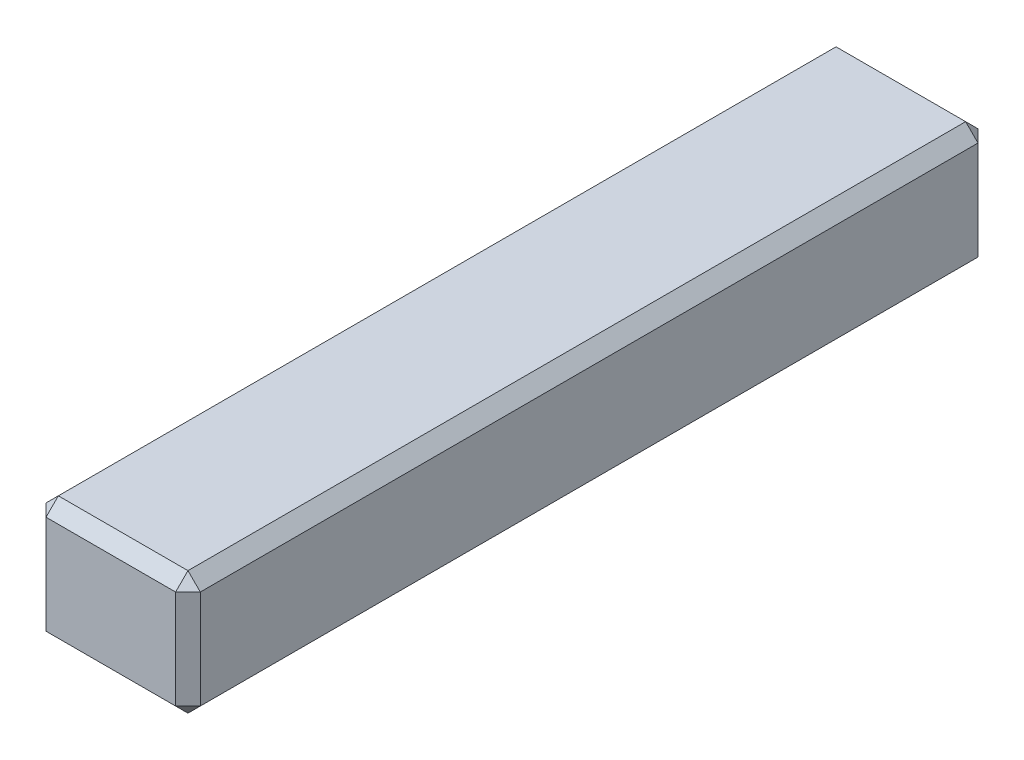
from build123d import *

# Parameters (mm, degrees)
SKETCH_1_W      = 2.5
SKETCH_1_H      = 13
EXTRUDE_1_DEPTH = 1
CHAMFER_1_SIZE  = 0.2


with BuildPart() as part:
    # 草图1 → 凸台-拉伸1 (new, symmetric)
    with BuildSketch(Plane(origin=(0, 0, 0), x_dir=(1, 0, 0), z_dir=(0, 1, 0))):
        Rectangle(SKETCH_1_W, SKETCH_1_H)
    extrude(amount=EXTRUDE_1_DEPTH, both=True)

    # 倒角1
    chamfer_1_edges = [part.edges().sort_by_distance(p)[0] for p in [
        (-1.25, 1, 0),
        (0, 1, 6.5),
        (1.25, 1, 0),
        (0, -1, 6.5),
        (-1.25, -1, 0),
        (0, -1, -6.5),
        (1.25, -1, 0),
        (1.25, 0, 6.5),
        (-1.25, 0, 6.5),
        (-1.25, 0, -6.5),
        (1.25, 0, -6.5),
        (0, 1, -6.5),
    ]]
    chamfer(chamfer_1_edges, length=CHAMFER_1_SIZE)


solid = part.part
